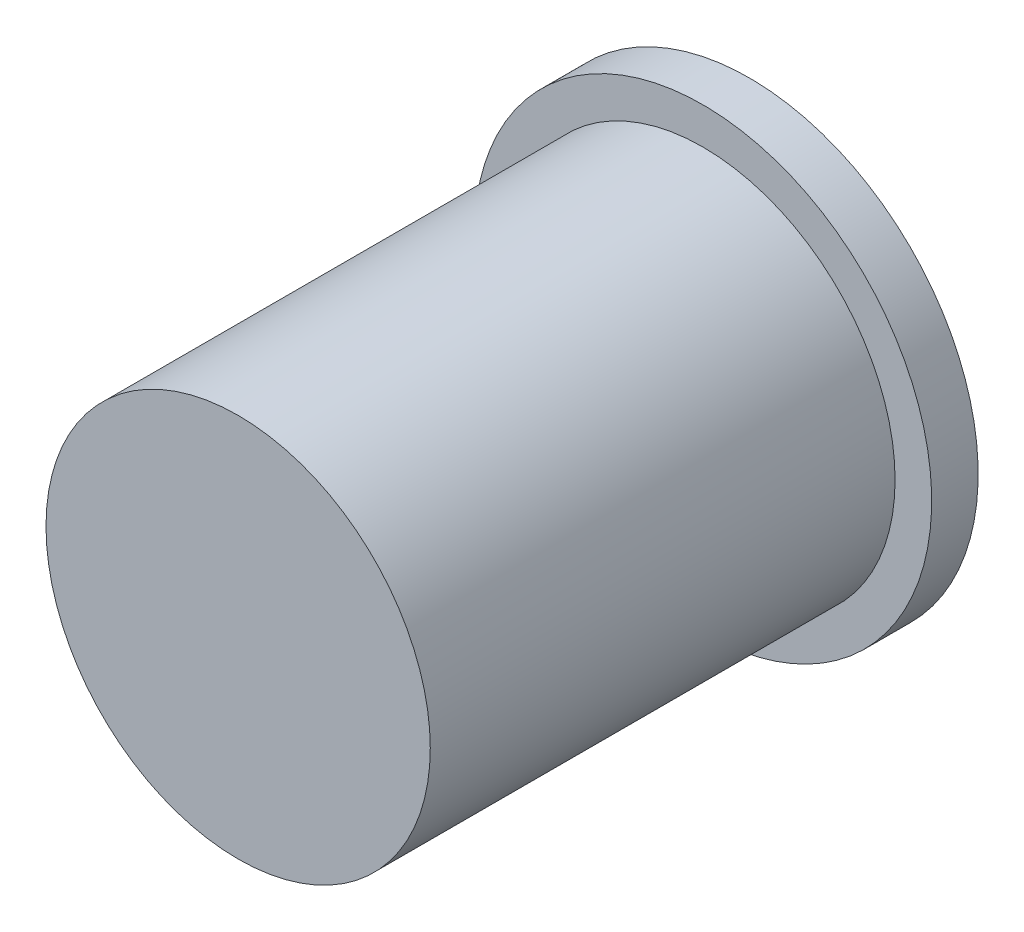
from build123d import *

# Parameters (mm, degrees)
SKETCH1_R           = 10.5
BOSS_EXTRUDE2_DEPTH = 27.94
SKETCH2_R           = 12.5
BOSS_EXTRUDE3_DEPTH = 2.54
SKETCH3_R           = 10
CUT_EXTRUDE2_DEPTH  = 25.4


with BuildPart() as part:
    # Sketch1 → Boss-Extrude2 (new body)
    with BuildSketch(Plane.XY):
        Circle(SKETCH1_R)
    extrude(amount=BOSS_EXTRUDE2_DEPTH)

    # Sketch2 → Boss-Extrude3 (add)
    with BuildSketch(Plane(origin=(0, 0, 0), x_dir=(-1, 0, 0), z_dir=(0, 0, -1))):
        Circle(SKETCH2_R)
    extrude(amount=-BOSS_EXTRUDE3_DEPTH)

    # Sketch3 → Cut-Extrude2 (cut)
    with BuildSketch(Plane(origin=(0, 0, 0), x_dir=(-1, 0, 0), z_dir=(0, 0, -1))):
        Circle(SKETCH3_R)
    extrude(amount=-CUT_EXTRUDE2_DEPTH, mode=Mode.SUBTRACT)


solid = part.part
